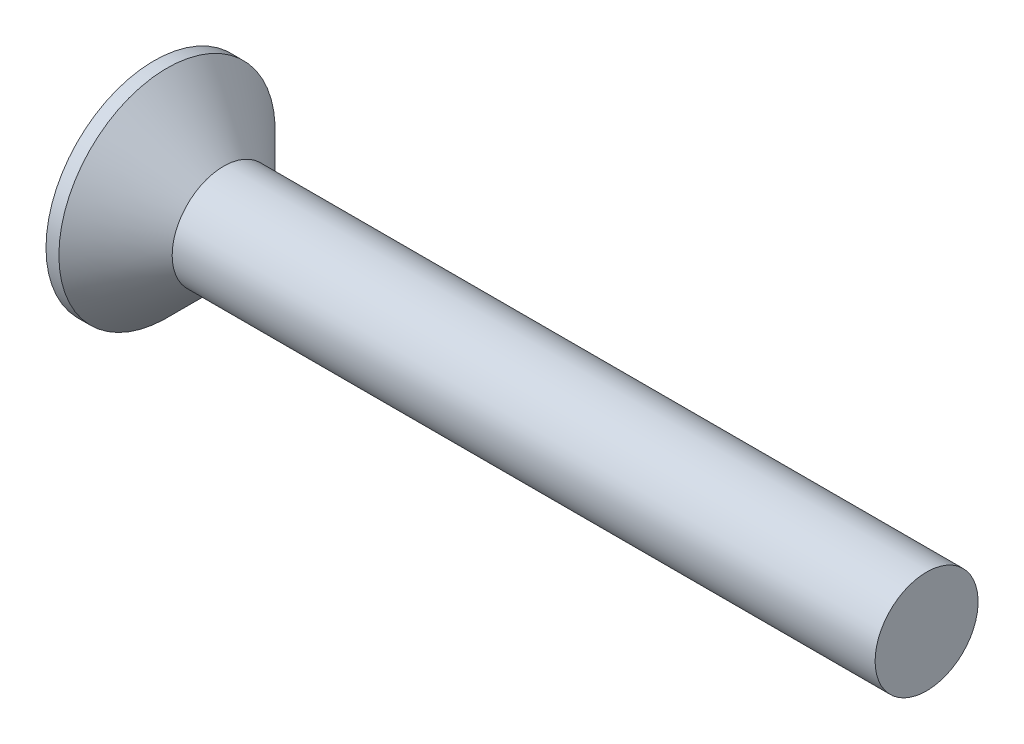
from build123d import *


with BuildPart() as part:
    # Esquisse1 → Révolution1 (revolve)
    with BuildSketch(Plane.XY, mode=Mode.PRIVATE) as r_volution1_sk:
        Polygon((0, 0), (30, 0), (30, 2), (2.7, 2), (0.5, 4.2), (0, 4.2), align=None)
    revolve(r_volution1_sk.sketch.rotate(Axis((0, 0, 0), (1, 0, 0)), 90), axis=Axis((0, 0, 0), (1, 0, 0)))


solid = part.part
